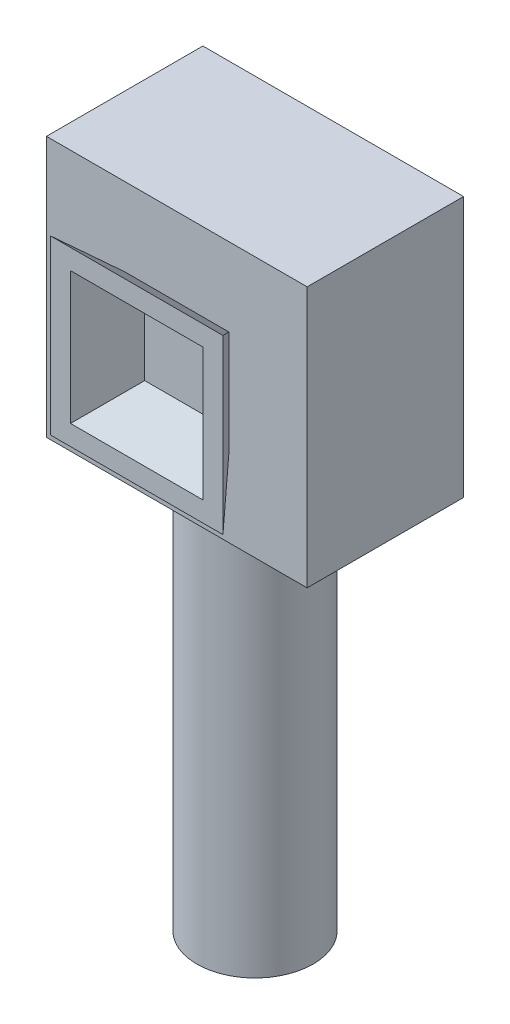
from build123d import *

# Parameters (mm, degrees)
Y_KSEKLIK_EKSTR_ZYON1_DEPTH = 10
IZIM3_W                     = 33
IZIM3_H                     = 33
KES_EKSTR_ZYON1_DEPTH       = 10
KES_EKSTR_ZYON1_DRAFT       = -40.36453657
IZIM7_OUTSIDE_W             = 57.326
IZIM7_OUTSIDE_H             = 24.326
KES_EKSTR_ZYON6_DEPTH       = 56
IZIM10_OUTSIDE_W            = 24.326
IZIM10_OUTSIDE_H            = 57.326
KES_EKSTR_ZYON8_DEPTH       = 28
Y_KSEKLIK_EKSTR_ZYON2_DEPTH = 39
IZIM12_R                    = 14.5
Y_KSEKLIK_EKSTR_ZYON3_DEPTH = 100
Y_KSEKLIK_EKSTR_ZYON4_DEPTH = 2


with BuildPart() as part:
    # Çizim2 → Yükseklik-Ekstrüzyon1 (new body)
    with BuildSketch(Plane.XY):
        Polygon((0, 16.5), (0, 21.5), (-21.5, 21.5), (-21.5, 0), (-16.5, 0), (-16.5, 16.5), align=None)
        Polygon((0, 8), (0, 16.5), (-16.5, 16.5), (-16.5, 0), (-8, 0), (-8, 8), align=None)
        Polygon((-21.5, -21.5), (0, -21.5), (0, -16.5), (-16.5, -16.5), (-16.5, 0), (-21.5, 0), align=None)
        Polygon((-16.5, -16.5), (0, -16.5), (0, -8), (-8, -8), (-8, 0), (-16.5, 0), align=None)
        Polygon((21.5, -21.5), (21.5, 0), (16.5, 0), (16.5, -16.5), (0, -16.5), (0, -21.5), align=None)
        Polygon((16.5, -16.5), (16.5, 0), (8, 0), (8, -8), (0, -8), (0, -16.5), align=None)
        Polygon((8, 0), (16.5, 0), (16.5, 16.5), (0, 16.5), (0, 8), (8, 8), align=None)
        Polygon((16.5, 0), (21.5, 0), (21.5, 21.5), (0, 21.5), (0, 16.5), (16.5, 16.5), align=None)
    extrude(amount=Y_KSEKLIK_EKSTR_ZYON1_DEPTH)


with BuildPart() as kes_ekstr_zyon1_tool:
    # Çizim3 → Kes-Ekstrüzyon1 (with draft: the straight prism first)
    with BuildSketch(Plane.XY.offset(10)):
        Rectangle(IZIM3_W, IZIM3_H)
    extrude(amount=-KES_EKSTR_ZYON1_DEPTH)
    # Kes-Ekstrüzyon1: the draft: its side faces are tilted about the plane it starts from
    kes_ekstr_zyon1_sides = [kes_ekstr_zyon1_tool.faces().sort_by_distance(p)[0] for p in [
        (-16.5, 0, 5),
        (0, -16.5, 5),
        (16.5, 0, 5),
        (0, 16.5, 5),
    ]]
    draft(kes_ekstr_zyon1_sides, Plane.XY.offset(10), KES_EKSTR_ZYON1_DRAFT)


with BuildPart() as part_1:
    add(part.part)

    # Kes-Ekstrüzyon1: cut by kes_ekstr_zyon1_tool
    add(kes_ekstr_zyon1_tool.part, mode=Mode.SUBTRACT)

    # Çizim7 outside → Kes-Ekstrüzyon6 (cut)
    with BuildSketch(Plane(origin=(0, 21.5, 0), x_dir=(1, 0, 0), z_dir=(0, 1, 0))):
        with Locations((0, -5)):
            Rectangle(IZIM7_OUTSIDE_W, IZIM7_OUTSIDE_H)
        Polygon((-21.5, -10), (21.5, -10), (13, 0), (-13, 0), align=None, mode=Mode.SUBTRACT)
    extrude(amount=-KES_EKSTR_ZYON6_DEPTH, mode=Mode.SUBTRACT)

    # Çizim10 outside → Kes-Ekstrüzyon8 (cut, symmetric)
    with BuildSketch(Plane(origin=(0, 0, 0), x_dir=(0, 0, -1), z_dir=(1, 0, 0))):
        with Locations((-5, 0)):
            Rectangle(IZIM10_OUTSIDE_W, IZIM10_OUTSIDE_H)
        Polygon((-10, 21.5), (-10, -21.5), (0, -13), (0, 13), align=None, mode=Mode.SUBTRACT)
    extrude(amount=KES_EKSTR_ZYON8_DEPTH, both=True, mode=Mode.SUBTRACT)

    # Çizim11 → Yükseklik-Ekstrüzyon2 (add)
    with BuildSketch(Plane(origin=(0, 0, 0), x_dir=(-1, 0, 0), z_dir=(0, 0, -1))):
        Polygon((-13, -13), (-32.5, -32.5), (32.5, -32.5), (32.5, 32.5), (13, 13), (13, -13), align=None)
        Polygon((-32.5, 32.5), (-32.5, -32.5), (-13, -13), (-13, 13), (13, 13), (32.5, 32.5), align=None)
        Polygon((-13, 13), (-13, -13), (-8.000000001, -8.000000001), (-8, 8), (8.000000001, 8.000000001), (13, 13), align=None)
        Polygon((-8, 8), (-8.000000001, -8.000000001), (8.000000001, 8.000000001), align=None)
        Polygon((8.000000001, 8.000000001), (-8.000000001, -8.000000001), (8.000000001, -8.000000001), align=None)
        Polygon((-8.000000001, -8.000000001), (-13, -13), (13, -13), (13, 13), (8.000000001, 8.000000001), (8.000000001, -8.000000001), align=None)
    extrude(amount=Y_KSEKLIK_EKSTR_ZYON2_DEPTH)

    # Çizim12 → Yükseklik-Ekstrüzyon3 (add)
    with BuildSketch(Plane.XZ.offset(32.5)):
        with Locations((0, -19.5)):
            Circle(IZIM12_R)
    extrude(amount=Y_KSEKLIK_EKSTR_ZYON3_DEPTH)

    # Çizim13 → Yükseklik-Ekstrüzyon4 (add)
    with BuildSketch(Plane.XZ.offset(132.5)):
        Polygon((-1, -31.880933569), (1, -31.880933569), (0, -33.652876783), align=None)
        Polygon((-3.663034054, -33.170629201), (-2.238495577, -31.717882533), (-4.17034723, -31.200244443), align=None)
        Polygon((-7.076438392, -31.756750831), (-5.324441381, -30.722202993), (-7.056492188, -29.722202993), align=None)
        Polygon((-10.007595147, -29.507595147), (-8.047535303, -28.961748865), (-9.461748865, -27.547535303), align=None)
        Polygon((-12.256750831, -26.576438392), (-10.222202993, -26.556492188), (-11.222202993, -24.824441381), align=None)
        Polygon((-13.670629201, -23.163034054), (-11.700244443, -23.67034723), (-12.217882533, -21.738495578), align=None)
        Polygon((-14.152876783, -19.5), (-12.380933569, -20.5), (-12.380933569, -18.5), align=None)
    extrude(amount=Y_KSEKLIK_EKSTR_ZYON4_DEPTH)


solid = part_1.part
